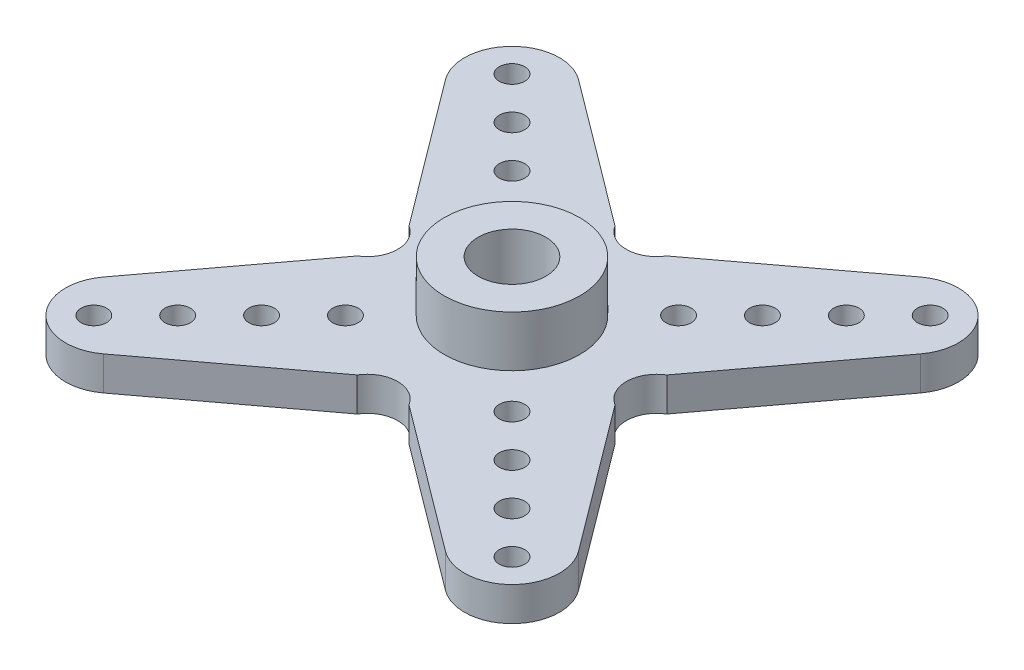
from build123d import *

# Parameters (mm, degrees)
BOSS_EXTRUDE1_DEPTH          = 2
SKETCH5_R                    = 4
SKETCH5_R_2                  = 1.998542518
BOSS_EXTRUDE2_DEPTH          = 3
SKETCH8_R                    = 1.5
CUT_EXTRUDE2_DEPTH           = 30.027201103
CUT_EXTRUDE3_REACH           = 31.027
SKETCH10_R                   = 0.75
LPATTERN1_COUNT              = 4
LPATTERN1_PITCH              = 3.5
CIRPATTERN1_COPY_1_REACH     = 31.027
CIRPATTERN1_COPY_1_SKETCH_R  = 0.75
CIRPATTERN1_COPY_2_REACH     = 31.027
CIRPATTERN1_COPY_2_SKETCH_R  = 0.75
CIRPATTERN1_COPY_3_REACH     = 31.027
CIRPATTERN1_COPY_3_SKETCH_R  = 0.75
CIRPATTERN1_COPY_4_REACH     = 31.027
CIRPATTERN1_COPY_4_SKETCH_R  = 0.75
CIRPATTERN1_COPY_5_REACH     = 31.027
CIRPATTERN1_COPY_5_SKETCH_R  = 0.75
CIRPATTERN1_COPY_6_REACH     = 31.027
CIRPATTERN1_COPY_6_SKETCH_R  = 0.75
CIRPATTERN1_COPY_7_REACH     = 31.027
CIRPATTERN1_COPY_7_SKETCH_R  = 0.75
CIRPATTERN1_COPY_8_REACH     = 31.027
CIRPATTERN1_COPY_8_SKETCH_R  = 0.75
CIRPATTERN1_COPY_9_REACH     = 31.027
CIRPATTERN1_COPY_9_SKETCH_R  = 0.75
CIRPATTERN1_COPY_10_REACH    = 31.027
CIRPATTERN1_COPY_10_SKETCH_R = 0.75
CIRPATTERN1_COPY_11_REACH    = 31.027
CIRPATTERN1_COPY_11_SKETCH_R = 0.75
CIRPATTERN1_COPY_12_REACH    = 31.027
CIRPATTERN1_COPY_12_SKETCH_R = 0.75


with BuildPart() as part:
    # Sketch1 → Boss-Extrude1 (new body)
    with BuildSketch(Plane(origin=(0, 0, 0), x_dir=(1, 0, 0), z_dir=(0, 1, 0))):
        with BuildLine():
            Line((11.195476756, 1.969359322), (4.786657556, -6.592741724))
            ThreePointArc((4.786657556, -6.592741724), (3.929987754, -8.118293207), (4.786657556, -9.643844691))
            Line((4.786657556, -9.643844691), (11.195476756, -18.205945736))
            ThreePointArc((11.195476756, -18.205945736), (10.933214648, -21.871520101), (7.267640283, -22.133782209))
            Line((7.267640283, -22.133782209), (-1.294460762, -15.724963009))
            ThreePointArc((-1.294460762, -15.724963009), (-2.820012246, -14.868293207), (-4.34556373, -15.724963009))
            Line((-4.34556373, -15.724963009), (-12.907664775, -22.133782209))
            ThreePointArc((-12.907664775, -22.133782209), (-16.57323914, -21.871520101), (-16.835501248, -18.205945736))
            Line((-16.835501248, -18.205945736), (-10.426682048, -9.643844691))
            ThreePointArc((-10.426682048, -9.643844691), (-9.570012246, -8.118293207), (-10.426682048, -6.592741724))
            Line((-10.426682048, -6.592741724), (-16.835501248, 1.969359322))
            ThreePointArc((-16.835501248, 1.969359322), (-16.57323914, 5.634933687), (-12.907664775, 5.897195795))
            Line((-12.907664775, 5.897195795), (-4.34556373, -0.511623405))
            ThreePointArc((-4.34556373, -0.511623405), (-2.820012246, -1.368293207), (-1.294460762, -0.511623405))
            Line((-1.294460762, -0.511623405), (7.267640283, 5.897195795))
            ThreePointArc((7.267640283, 5.897195795), (10.933214648, 5.634933687), (11.195476756, 1.969359322))
        make_face()
    extrude(amount=BOSS_EXTRUDE1_DEPTH)

    # Sketch5 → Boss-Extrude2 (add)
    with BuildSketch(Plane(origin=(0, 2, 0), x_dir=(1, 0, 0), z_dir=(0, 1, 0))):
        with Locations((-2.820012246, -8.118293207)):
            Circle(SKETCH5_R)
        with Locations((-2.820012246, -8.118293207)):
            Circle(SKETCH5_R_2, mode=Mode.SUBTRACT)
    extrude(amount=BOSS_EXTRUDE2_DEPTH)

    # Sketch8 → Cut-Extrude2 (cut, through all)
    with BuildSketch(Plane.XZ):
        with Locations((-2.820012246, 8.118293207)):
            Circle(SKETCH8_R)
    extrude(amount=-CUT_EXTRUDE2_DEPTH, mode=Mode.SUBTRACT)

    # Sketch10 → Cut-Extrude3 (cut, up to next)
    with BuildSketch(Plane.XZ, mode=Mode.PRIVATE) as cut_extrude3_sk1:
        with Locations((9.519001086, -4.220720125)):
            Circle(SKETCH10_R)
    cut_extrude3_tool1 = extrude(cut_extrude3_sk1.sketch, amount=-CUT_EXTRUDE3_REACH, mode=Mode.PRIVATE) & part.part
    cut_extrude3 = cut_extrude3_tool1.solids().sort_by_distance((9.519001, 0, -4.22072))[0]
    add(cut_extrude3, mode=Mode.SUBTRACT)

    # LPattern1: Cut-Extrude3 ×4
    with Locations(*[Vector(-0.707106781186547, 0, 0.707106781186548) * (i * LPATTERN1_PITCH) for i in range(1, LPATTERN1_COUNT)]):
        add(cut_extrude3, mode=Mode.SUBTRACT)

    # CirPattern1 copy 1 sketch → CirPattern1 copy 1 (cut, up to next)
    with BuildSketch(Plane(origin=(2.823407227, 0, 8.463431719), x_dir=(0, 0, 1), z_dir=(0, -1, 0)), mode=Mode.PRIVATE) as cirpattern1_copy_1_sk1:
        with Locations((9.519001086, -4.220720125)):
            Circle(CIRPATTERN1_COPY_1_SKETCH_R)
    cirpattern1_copy_1_tool1 = extrude(cirpattern1_copy_1_sk1.sketch, amount=-CIRPATTERN1_COPY_1_REACH, mode=Mode.PRIVATE) & part.part
    add(cirpattern1_copy_1_tool1.solids().sort_by_distance((7.044127227, 0, 17.982432719))[0], mode=Mode.SUBTRACT)

    # CirPattern1 copy 2 sketch → CirPattern1 copy 2 (cut, up to next)
    with BuildSketch(Plane(origin=(-3.165150758, 0, 13.76171268), x_dir=(-1, 0, 0), z_dir=(0, -1, 0)), mode=Mode.PRIVATE) as cirpattern1_copy_2_sk1:
        with Locations((9.519001086, -4.220720125)):
            Circle(CIRPATTERN1_COPY_2_SKETCH_R)
    cirpattern1_copy_2_tool1 = extrude(cirpattern1_copy_2_sk1.sketch, amount=-CIRPATTERN1_COPY_2_REACH, mode=Mode.PRIVATE) & part.part
    add(cirpattern1_copy_2_tool1.solids().sort_by_distance((-12.684151758, 0, 17.98243268))[0], mode=Mode.SUBTRACT)

    # CirPattern1 copy 3 sketch → CirPattern1 copy 3 (cut, up to next)
    with BuildSketch(Plane(origin=(-8.463431719, 0, 7.773154695), x_dir=(0, 0, -1), z_dir=(0, -1, 0)), mode=Mode.PRIVATE) as cirpattern1_copy_3_sk1:
        with Locations((9.519001086, -4.220720125)):
            Circle(CIRPATTERN1_COPY_3_SKETCH_R)
    cirpattern1_copy_3_tool1 = extrude(cirpattern1_copy_3_sk1.sketch, amount=-CIRPATTERN1_COPY_3_REACH, mode=Mode.PRIVATE) & part.part
    add(cirpattern1_copy_3_tool1.solids().sort_by_distance((-12.684151719, 0, -1.745846305))[0], mode=Mode.SUBTRACT)

    # CirPattern1 copy 4 sketch → CirPattern1 copy 4 (cut, up to next)
    with BuildSketch(Plane(origin=(0.348533493, 0, 5.988557985), x_dir=(0, 0, 1), z_dir=(0, -1, 0)), mode=Mode.PRIVATE) as cirpattern1_copy_4_sk1:
        with Locations((9.519001086, -4.220720125)):
            Circle(CIRPATTERN1_COPY_4_SKETCH_R)
    cirpattern1_copy_4_tool1 = extrude(cirpattern1_copy_4_sk1.sketch, amount=-CIRPATTERN1_COPY_4_REACH, mode=Mode.PRIVATE) & part.part
    add(cirpattern1_copy_4_tool1.solids().sort_by_distance((4.569253493, 0, 15.507558985))[0], mode=Mode.SUBTRACT)

    # CirPattern1 copy 5 sketch → CirPattern1 copy 5 (cut, up to next)
    with BuildSketch(Plane(origin=(-0.690277024, 0, 11.286838946), x_dir=(-1, 0, 0), z_dir=(0, -1, 0)), mode=Mode.PRIVATE) as cirpattern1_copy_5_sk1:
        with Locations((9.519001086, -4.220720125)):
            Circle(CIRPATTERN1_COPY_5_SKETCH_R)
    cirpattern1_copy_5_tool1 = extrude(cirpattern1_copy_5_sk1.sketch, amount=-CIRPATTERN1_COPY_5_REACH, mode=Mode.PRIVATE) & part.part
    add(cirpattern1_copy_5_tool1.solids().sort_by_distance((-10.209278024, 0, 15.507558946))[0], mode=Mode.SUBTRACT)

    # CirPattern1 copy 6 sketch → CirPattern1 copy 6 (cut, up to next)
    with BuildSketch(Plane(origin=(-5.988557985, 0, 10.248028429), x_dir=(0, 0, -1), z_dir=(0, -1, 0)), mode=Mode.PRIVATE) as cirpattern1_copy_6_sk1:
        with Locations((9.519001086, -4.220720125)):
            Circle(CIRPATTERN1_COPY_6_SKETCH_R)
    cirpattern1_copy_6_tool1 = extrude(cirpattern1_copy_6_sk1.sketch, amount=-CIRPATTERN1_COPY_6_REACH, mode=Mode.PRIVATE) & part.part
    add(cirpattern1_copy_6_tool1.solids().sort_by_distance((-10.209277985, 0, 0.729027429))[0], mode=Mode.SUBTRACT)

    # CirPattern1 copy 7 sketch → CirPattern1 copy 7 (cut, up to next)
    with BuildSketch(Plane(origin=(-2.126340241, 0, 3.513684251), x_dir=(0, 0, 1), z_dir=(0, -1, 0)), mode=Mode.PRIVATE) as cirpattern1_copy_7_sk1:
        with Locations((9.519001086, -4.220720125)):
            Circle(CIRPATTERN1_COPY_7_SKETCH_R)
    cirpattern1_copy_7_tool1 = extrude(cirpattern1_copy_7_sk1.sketch, amount=-CIRPATTERN1_COPY_7_REACH, mode=Mode.PRIVATE) & part.part
    add(cirpattern1_copy_7_tool1.solids().sort_by_distance((2.094379759, 0, 13.032685251))[0], mode=Mode.SUBTRACT)

    # CirPattern1 copy 8 sketch → CirPattern1 copy 8 (cut, up to next)
    with BuildSketch(Plane(origin=(1.78459671, 0, 8.811965212), x_dir=(-1, 0, 0), z_dir=(0, -1, 0)), mode=Mode.PRIVATE) as cirpattern1_copy_8_sk1:
        with Locations((9.519001086, -4.220720125)):
            Circle(CIRPATTERN1_COPY_8_SKETCH_R)
    cirpattern1_copy_8_tool1 = extrude(cirpattern1_copy_8_sk1.sketch, amount=-CIRPATTERN1_COPY_8_REACH, mode=Mode.PRIVATE) & part.part
    add(cirpattern1_copy_8_tool1.solids().sort_by_distance((-7.73440429, 0, 13.032685212))[0], mode=Mode.SUBTRACT)

    # CirPattern1 copy 9 sketch → CirPattern1 copy 9 (cut, up to next)
    with BuildSketch(Plane(origin=(-3.513684251, 0, 12.722902164), x_dir=(0, 0, -1), z_dir=(0, -1, 0)), mode=Mode.PRIVATE) as cirpattern1_copy_9_sk1:
        with Locations((9.519001086, -4.220720125)):
            Circle(CIRPATTERN1_COPY_9_SKETCH_R)
    cirpattern1_copy_9_tool1 = extrude(cirpattern1_copy_9_sk1.sketch, amount=-CIRPATTERN1_COPY_9_REACH, mode=Mode.PRIVATE) & part.part
    add(cirpattern1_copy_9_tool1.solids().sort_by_distance((-7.734404251, 0, 3.203901164))[0], mode=Mode.SUBTRACT)

    # CirPattern1 copy 10 sketch → CirPattern1 copy 10 (cut, up to next)
    with BuildSketch(Plane(origin=(5.298280961, 0, 10.938305453), x_dir=(0, 0, 1), z_dir=(0, -1, 0)), mode=Mode.PRIVATE) as cirpattern1_copy_10_sk1:
        with Locations((9.519001086, -4.220720125)):
            Circle(CIRPATTERN1_COPY_10_SKETCH_R)
    cirpattern1_copy_10_tool1 = extrude(cirpattern1_copy_10_sk1.sketch, amount=-CIRPATTERN1_COPY_10_REACH, mode=Mode.PRIVATE) & part.part
    add(cirpattern1_copy_10_tool1.solids().sort_by_distance((9.519000961, 0, 20.457306453))[0], mode=Mode.SUBTRACT)

    # CirPattern1 copy 11 sketch → CirPattern1 copy 11 (cut, up to next)
    with BuildSketch(Plane(origin=(-5.640024492, 0, 16.236586414), x_dir=(-1, 0, 0), z_dir=(0, -1, 0)), mode=Mode.PRIVATE) as cirpattern1_copy_11_sk1:
        with Locations((9.519001086, -4.220720125)):
            Circle(CIRPATTERN1_COPY_11_SKETCH_R)
    cirpattern1_copy_11_tool1 = extrude(cirpattern1_copy_11_sk1.sketch, amount=-CIRPATTERN1_COPY_11_REACH, mode=Mode.PRIVATE) & part.part
    add(cirpattern1_copy_11_tool1.solids().sort_by_distance((-15.159025492, 0, 20.457306414))[0], mode=Mode.SUBTRACT)

    # CirPattern1 copy 12 sketch → CirPattern1 copy 12 (cut, up to next)
    with BuildSketch(Plane(origin=(-10.938305453, 0, 5.298280961), x_dir=(0, 0, -1), z_dir=(0, -1, 0)), mode=Mode.PRIVATE) as cirpattern1_copy_12_sk1:
        with Locations((9.519001086, -4.220720125)):
            Circle(CIRPATTERN1_COPY_12_SKETCH_R)
    cirpattern1_copy_12_tool1 = extrude(cirpattern1_copy_12_sk1.sketch, amount=-CIRPATTERN1_COPY_12_REACH, mode=Mode.PRIVATE) & part.part
    add(cirpattern1_copy_12_tool1.solids().sort_by_distance((-15.159025453, 0, -4.220720039))[0], mode=Mode.SUBTRACT)


solid = part.part
